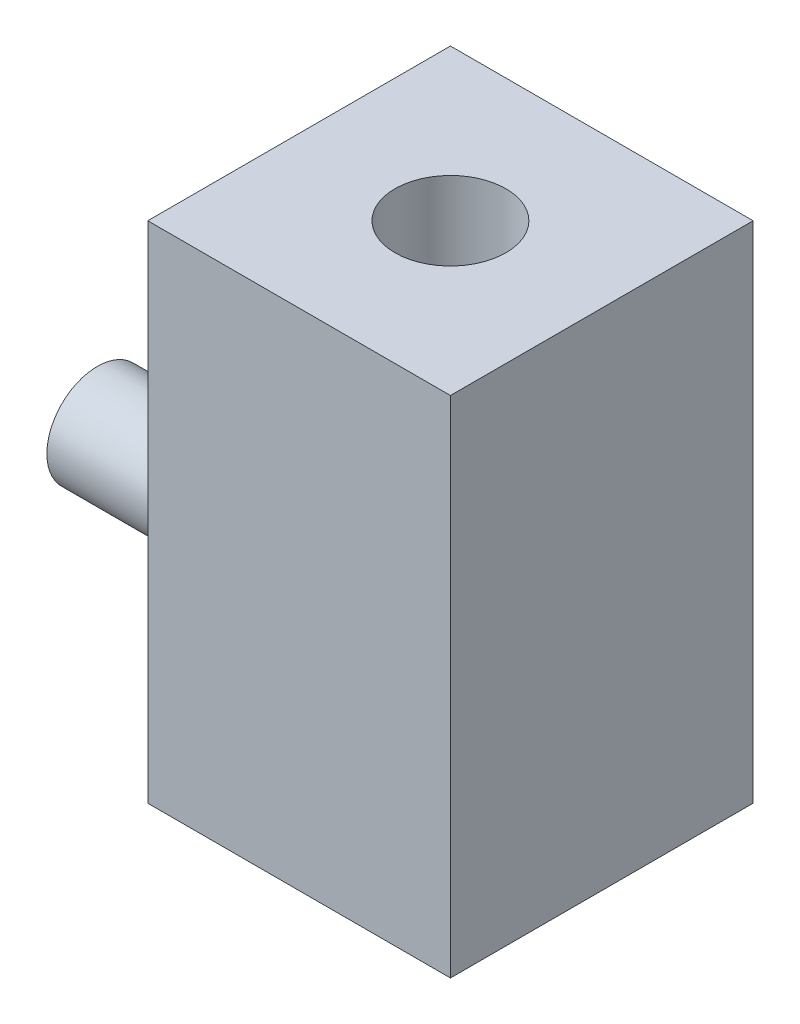
from build123d import *

# Parameters (mm, degrees)
SKETCH1_W           = 76.2
SKETCH1_H           = 127
BOSS_EXTRUDE1_DEPTH = 76.2
SKETCH2_R           = 13.97
CUT_EXTRUDE1_DEPTH  = 48.26
SKETCH3_R           = 12.7
BOSS_EXTRUDE2_DEPTH = 50.8


with BuildPart() as part:
    # Sketch1 → Boss-Extrude1 (new body)
    with BuildSketch(Plane.XY):
        Rectangle(SKETCH1_W, SKETCH1_H)
    extrude(amount=BOSS_EXTRUDE1_DEPTH)

    # Sketch2 → Cut-Extrude1 (cut)
    with BuildSketch(Plane(origin=(0, 63.5, 0), x_dir=(1, 0, 0), z_dir=(0, 1, 0))):
        with Locations(Location((0, -38.1, 0), (0, 0, 270))):
            Circle(SKETCH2_R)
    extrude(amount=-CUT_EXTRUDE1_DEPTH, mode=Mode.SUBTRACT)

    # Sketch3 → Boss-Extrude2 (add)
    with BuildSketch(Plane.ZY.offset(38.1)):
        with Locations(Location((38.1, -25.4, 0), (0, 0, 270))):
            Circle(SKETCH3_R)
    extrude(amount=BOSS_EXTRUDE2_DEPTH)


solid = part.part
